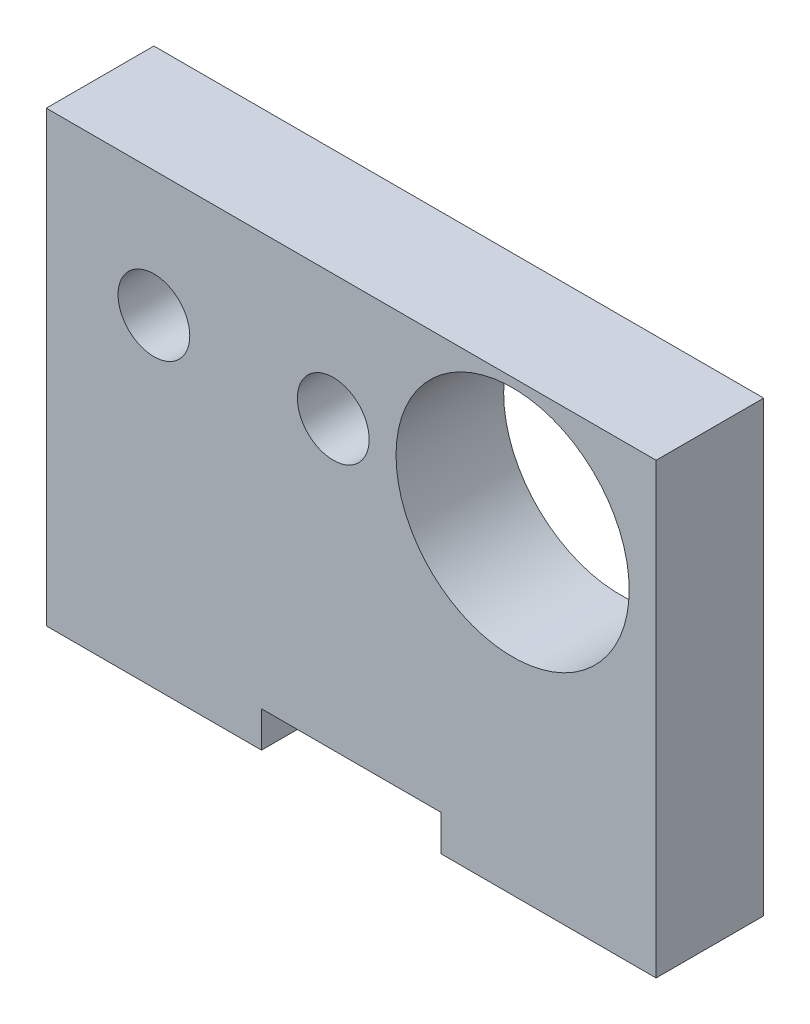
from build123d import *

# Parameters (mm, degrees)
BOSS_EXTRU_1_DEPTH      = 6
ESQUISSE2_R             = 2
ESQUISSE2_R_2           = 6.5
ENL_V_MAT_EXTRU_1_DEPTH = 43.626282972


with BuildPart() as part:
    # Esquisse1 → Boss.-Extru.1 (new body)
    with BuildSketch(Plane.XY):
        Polygon((22, 0), (34, 0), (34, 25), (0, 25), (0, 0), (12, 0), (12, 2), (22, 2), align=None)
    extrude(amount=BOSS_EXTRU_1_DEPTH)

    # Esquisse2 → Enlèv. mat.-Extru.1 (cut, through all)
    with BuildSketch(Plane.XY.offset(6)):
        with Locations((16, 18)):
            Circle(ESQUISSE2_R)
        with Locations((26, 18)):
            Circle(ESQUISSE2_R_2)
        with Locations((6, 18)):
            Circle(ESQUISSE2_R)
    extrude(amount=-ENL_V_MAT_EXTRU_1_DEPTH, mode=Mode.SUBTRACT)


solid = part.part
